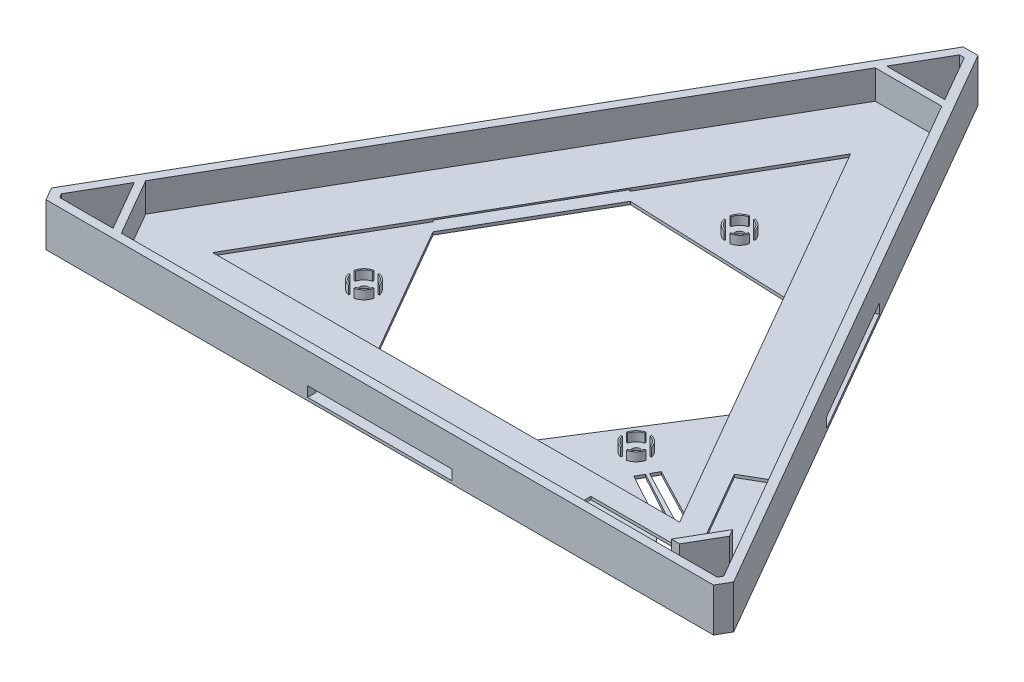
from build123d import *

# Parameters (mm, degrees)
SKETCH1_W                = 34.714871787
SKETCH1_H                = 10.923666426
BOSS_EXTRUDE1_DEPTH      = 1
BOSS_EXTRUDE2_DEPTH      = 11
BOSS_EXTRUDE3_DEPTH      = 5
BOSS_EXTRUDE3_DEPTH_BACK = 3
SKETCH3_W                = 50
SKETCH3_H                = 7
CUT_EXTRUDE3_DEPTH       = 25
SKETCH5_W                = 50
SKETCH5_H                = 7
CUT_EXTRUDE4_DEPTH       = 25
SKETCH6_W                = 50
SKETCH6_H                = 7
CUT_EXTRUDE5_DEPTH       = 25
SKETCH8_R                = 1.5
BOSS_EXTRUDE5_DEPTH      = 1
BOSS_EXTRUDE10_DEPTH     = 3


with BuildPart() as part:
    # Sketch1 → Boss-Extrude1 (new body)
    with BuildSketch(Plane(origin=(0, 0, 0), x_dir=(1, 0, 0), z_dir=(0, 1, 0))):
        Polygon((243.304219775, -116.484791865), (254.809280577, -136.408896137), (442.602090749, -136.409305398), (444.621046679, -132.925433224), (441.749040748, -132.925433224), (449.516726724, -119.471406458), (450.964695298, -121.978953123), (452.699916622, -118.984688018), (358.778179036, 43.666038065), (335.767496284, 43.666038065), align=None)
        with Locations((422.370878913, -129.522754792)):
            Rectangle(SKETCH1_W, SKETCH1_H, mode=Mode.SUBTRACT)
        Polygon((423.190377512, -92.577472767), (432.651287025, -87.114324326), (450.119365975, -117.364996826), (440.658456462, -122.828145267), align=None, mode=Mode.SUBTRACT)
        Polygon((428.113670919, -116.417164681), (266.439108268, -116.428009237), (347.273609729, 23.609230821), align=None, mode=Mode.SUBTRACT)
    extrude(amount=BOSS_EXTRUDE1_DEPTH)

    # Sketch1<9> → Boss-Extrude2 (add)
    # profile 1 of 2: a face of its own
    with BuildSketch(Plane(origin=(0, 0, 0), x_dir=(1, 0, 0), z_dir=(0, 1, 0))):
        Polygon((229.159432548, -134.984249184), (231.716666588, -139.412373829), (462.829865412, -139.412373829), (465.38624875, -134.984588004), (349.829542096, 65.165499075), (344.716133219, 65.165499075), align=None)
        Polygon((251.922647989, -136.409305399), (233.446303401, -136.408896138), (232.62355396, -134.984217357), (241.860901689, -118.984688018), align=None, mode=Mode.SUBTRACT)
        Polygon((442.602090749, -136.409305398), (254.809280577, -136.408896137), (243.304219775, -116.484791865), (335.767496284, 43.666038065), (358.778179036, 43.666038065), (461.938967958, -134.984588006), (461.116393749, -136.409305398), align=None, mode=Mode.SUBTRACT)
        Polygon((348.096628302, 62.164013367), (357.334800991, 46.166038067), (337.210874326, 46.166038067), (346.44844193, 62.165948237), align=None, mode=Mode.SUBTRACT)
    # profile 2 of 2: a face of its own
    with BuildSketch(Plane(origin=(0, 0, 0), x_dir=(1, 0, 0), z_dir=(0, 1, 0))):
        Polygon((441.749040748, -132.925433224), (444.621046679, -132.925433224), (450.964695298, -121.978953123), (449.516726724, -119.471406458), align=None)
    extrude(amount=BOSS_EXTRUDE2_DEPTH)

    # Sketch1<10> → Boss-Extrude3 (add, two sides: drawn at the far end of the back side and taken through both)
    # profile 1 of 2: a face of its own
    with BuildSketch(Plane(origin=(0, 0, 0), x_dir=(1, 0, 0), z_dir=(0, 1, 0)).offset(-BOSS_EXTRUDE3_DEPTH_BACK)):
        Polygon((229.159432548, -134.984249184), (231.716666588, -139.412373829), (462.829865412, -139.412373829), (465.38624875, -134.984588004), (349.829542096, 65.165499075), (344.716133219, 65.165499075), align=None)
        Polygon((251.922647989, -136.409305399), (233.446303401, -136.408896138), (232.62355396, -134.984217357), (241.860901689, -118.984688018), align=None, mode=Mode.SUBTRACT)
        Polygon((442.602090749, -136.409305398), (254.809280577, -136.408896137), (243.304219775, -116.484791865), (335.767496284, 43.666038065), (358.778179036, 43.666038065), (461.938967958, -134.984588006), (461.116393749, -136.409305398), align=None, mode=Mode.SUBTRACT)
        Polygon((348.096628302, 62.164013367), (357.334800991, 46.166038067), (337.210874326, 46.166038067), (346.44844193, 62.165948237), align=None, mode=Mode.SUBTRACT)
    # profile 2 of 2: a face of its own
    with BuildSketch(Plane(origin=(0, 0, 0), x_dir=(1, 0, 0), z_dir=(0, 1, 0)).offset(-BOSS_EXTRUDE3_DEPTH_BACK)):
        Polygon((441.749040748, -132.925433224), (444.621046679, -132.925433224), (450.964695298, -121.978953123), (449.516726724, -119.471406458), align=None)
    extrude(amount=BOSS_EXTRUDE3_DEPTH + BOSS_EXTRUDE3_DEPTH_BACK)

    # Sketch3 → Cut-Extrude3 (cut)
    with BuildSketch(Plane(origin=(290.589645397, 0, -167.772009994), x_dir=(-0.49999999999998745, 0, -0.8660254037844459), z_dir=(0.8660254037844459, 0, -0.49999999999998745))):
        with Locations((-236.592990632, -3)):
            Rectangle(SKETCH3_W, SKETCH3_H)
    extrude(amount=-CUT_EXTRUDE3_DEPTH, mode=Mode.SUBTRACT)

    # Sketch5 → Cut-Extrude4 (cut)
    with BuildSketch(Plane.XY.offset(139.412373829)):
        with Locations((347.273266, -3)):
            Rectangle(SKETCH5_W, SKETCH5_H)
    extrude(amount=-CUT_EXTRUDE4_DEPTH, mode=Mode.SUBTRACT)

    # Sketch6 → Cut-Extrude5 (cut)
    with BuildSketch(Plane(origin=(230.319375798, 0, 132.975171837), x_dir=(-0.5000006154012504, 0, 0.8660250484820695), z_dir=(-0.8660250484820695, 0, -0.5000006154012504))):
        with Locations((-113.236674799, -3)):
            Rectangle(SKETCH6_W, SKETCH6_H)
    extrude(amount=-CUT_EXTRUDE5_DEPTH, mode=Mode.SUBTRACT)

    # Sketch8 → Boss-Extrude5 (add)
    with BuildSketch(Plane.XZ.offset(3)):
        Polygon((349.829542096, -65.165499075), (465.38624875, 134.984588004), (462.829865412, 139.412373829), (231.716666588, 139.412373829), (229.159432548, 134.984249184), (344.716133219, -65.165499075), align=None)
        with Locations(Location((395.323540807, 98.692824234, 0), (0, 0, 270))):
            Circle(SKETCH8_R, mode=Mode.SUBTRACT)
        with Locations(Location((348.301285091, 15.863526629, 0), (0, 0, 270))):
            Circle(SKETCH8_R, mode=Mode.SUBTRACT)
        with Locations(Location((299.654911442, 97.24168178, 0), (0, 0, 270))):
            Circle(SKETCH8_R, mode=Mode.SUBTRACT)
        Polygon((444.621046679, 132.925433224), (450.964695298, 121.978953123), (449.516726724, 119.471406458), (427.347592194, 115.090208207), (404.33298615, 103.060878104), (405.774939109, 100.430142149), (424.549299543, 110.243170393), (451.871255231, 117.549638152), (452.699916622, 118.984688018), (461.938967958, 134.984588006), (461.116393749, 136.409305398), (442.602090749, 136.409305398), (439.019602541, 136.409297591), (420.379437571, 116.417683466), (402.410382205, 106.568526044), (403.852335164, 103.937790089), (426.620208946, 116.417264857), (441.749040748, 132.925433224), align=None, mode=Mode.SUBTRACT)
        Polygon((322.273266, 116.42426408), (294.358218631, 68.061097964), (319.354499367, 24.757680453), (376.473657316, 26.969372806), (401.47267951, 70.271207531), (372.273266, 116.420910257), align=None, mode=Mode.SUBTRACT)
        Polygon((233.446303401, 136.408896138), (251.922647989, 136.409305399), (241.860901689, 118.984688018), (232.62355396, 134.984217357), align=None, mode=Mode.SUBTRACT)
        Polygon((337.210874326, -46.166038067), (357.334800991, -46.166038067), (348.096628302, -62.164013367), (346.44844193, -62.165948237), align=None, mode=Mode.SUBTRACT)
    extrude(amount=BOSS_EXTRUDE5_DEPTH)

    # Sketch12 → Boss-Extrude10 (add)
    with BuildSketch(Plane(origin=(0, -3, 0), x_dir=(1, 0, 0), z_dir=(0, 1, 0))):
        with BuildLine():
            Line((347.417900211, -11.962292061), (347.307477101, -11.47463774))
            ThreePointArc((347.307477101, -11.47463774), (345.119304576, -12.681546114), (343.912396202, -14.869718639))
            Line((343.912396203, -14.869718639), (344.400050524, -14.980141749))
            ThreePointArc((344.400050523, -14.980141749), (345.472857967, -13.035099504), (347.417900211, -11.962292061))
        make_face()
        with BuildLine():
            ThreePointArc((352.690173981, -14.869718639), (351.483265607, -12.681546114), (349.295093082, -11.47463774))
            Line((349.295093081, -11.47463774), (349.184669971, -11.962292061))
            ThreePointArc((349.184669972, -11.962292061), (351.129712216, -13.035099504), (352.20251966, -14.980141749))
            Line((352.202519659, -14.980141749), (352.69017398, -14.869718639))
        make_face()
        with BuildLine():
            ThreePointArc((349.295093082, -20.252415518), (351.483265607, -19.045507145), (352.690173981, -16.857334619))
            Line((352.69017398, -16.857334619), (352.202519659, -16.746911509))
            ThreePointArc((352.20251966, -16.746911509), (351.129712216, -18.691953754), (349.184669972, -19.764761197))
            Line((349.184669971, -19.764761197), (349.295093081, -20.252415518))
        make_face()
        with BuildLine():
            Line((344.400050524, -16.746911509), (343.912396203, -16.857334619))
            ThreePointArc((343.912396202, -16.857334619), (345.119304576, -19.045507145), (347.307477101, -20.252415518))
            Line((347.307477101, -20.252415518), (347.417900211, -19.764761197))
            ThreePointArc((347.417900211, -19.764761197), (345.472857967, -18.691953754), (344.400050523, -16.746911509))
        make_face()
        with BuildLine():
            Line((394.440155927, -94.791589666), (394.329732817, -94.303935345))
            ThreePointArc((394.329732817, -94.303935345), (392.141560292, -95.510843718), (390.934651918, -97.699016244))
            Line((390.934651918, -97.699016244), (391.4247896, -97.798542945))
            ThreePointArc((391.4247896, -97.798542945), (392.499067689, -95.860448622), (394.440155927, -94.791589666))
        make_face()
        with BuildLine():
            ThreePointArc((399.712429696, -97.699016244), (398.505521323, -95.510843718), (396.317348797, -94.303935345))
            Line((396.317348797, -94.303935345), (396.206925687, -94.791589666))
            ThreePointArc((396.206925687, -94.791589666), (398.151967932, -95.864397109), (399.224775375, -97.809439354))
            Line((399.224775375, -97.809439354), (399.712429696, -97.699016244))
        make_face()
        with BuildLine():
            ThreePointArc((396.317348797, -103.081713123), (398.505521323, -101.874804749), (399.712429696, -99.686632224))
            Line((399.712429696, -99.686632224), (399.224775375, -99.576209114))
            ThreePointArc((399.224775375, -99.576209114), (398.151967932, -101.521251358), (396.206925687, -102.594058802))
            Line((396.206925687, -102.594058801), (396.317348797, -103.081713122))
        make_face()
        with BuildLine():
            Line((391.422306239, -99.576209114), (390.934651918, -99.686632224))
            ThreePointArc((390.934651918, -99.686632224), (392.141560292, -101.874804749), (394.329732817, -103.081713123))
            Line((394.329732817, -103.081713122), (394.440155927, -102.594058801))
            ThreePointArc((394.440155927, -102.594058802), (392.495113682, -101.521251358), (391.422306239, -99.576209114))
        make_face()
        with BuildLine():
            ThreePointArc((298.661103452, -92.852792892), (296.472930927, -94.059701265), (295.266022553, -96.24787379))
            Line((295.266022553, -96.24787379), (295.753676874, -96.3582969))
            ThreePointArc((295.753676874, -96.3582969), (296.826484317, -94.413254656), (298.771526562, -93.340447213))
            Line((298.771526562, -93.340447212), (298.661103452, -92.852792891))
        make_face()
        with BuildLine():
            ThreePointArc((304.04380033, -96.24787379), (302.836891957, -94.059701265), (300.648719432, -92.852792892))
            Line((300.648719432, -92.852792891), (300.538296322, -93.340447212))
            ThreePointArc((300.538296322, -93.340447213), (302.483338566, -94.413254656), (303.55614601, -96.3582969))
            Line((303.55614601, -96.3582969), (304.043800331, -96.24787379))
        make_face()
        with BuildLine():
            Line((300.538296322, -101.142916348), (300.648719432, -101.630570669))
            ThreePointArc((300.648719432, -101.630570669), (302.836891957, -100.423662295), (304.04380033, -98.23548977))
            Line((304.043800331, -98.23548977), (303.55614601, -98.12506666))
            ThreePointArc((303.55614601, -98.12506666), (302.483338566, -100.070108905), (300.538296322, -101.142916348))
        make_face()
        with BuildLine():
            Line((295.753676874, -98.12506666), (295.266022553, -98.23548977))
            ThreePointArc((295.266022553, -98.23548977), (296.472930927, -100.423662295), (298.661103452, -101.630570669))
            Line((298.661103452, -101.630570669), (298.771526562, -101.142916348))
            ThreePointArc((298.771526562, -101.142916348), (296.826484317, -100.070108905), (295.753676874, -98.12506666))
        make_face()
    extrude(amount=BOSS_EXTRUDE10_DEPTH)


solid = part.part
